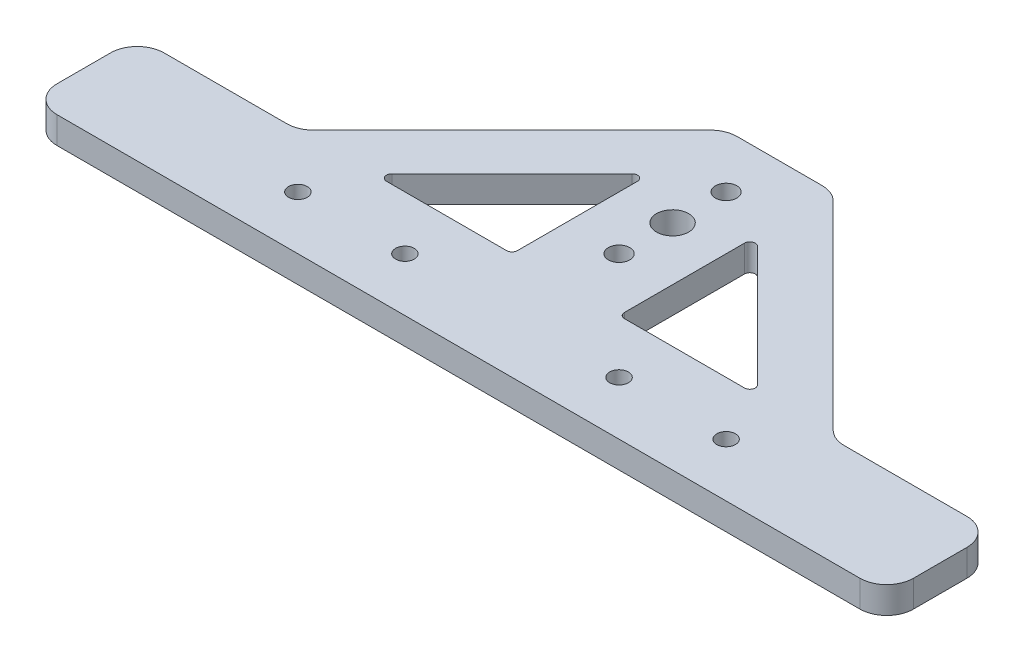
from build123d import *

# Parameters (mm, degrees)
ESBO_O1_R                = 1.75
RESSALTO_EXTRUS_O1_DEPTH = 5
ESBO_O4_W                = 30
ESBO_O4_H                = 20.000002677
RESSALTO_EXTRUS_O3_DEPTH = 5
ESBO_O5_R                = 3
CORTE_EXTRUS_O1_DEPTH    = 101.124923498
ESBO_O6_R                = 1.75
RESSALTO_EXTRUS_O5_DEPTH = 5
FILETE1_R                = 5
ESBO_O7_R                = 2
CORTE_EXTRUS_O2_DEPTH    = 101.124923498


with BuildPart() as part:
    # Esboço1 → Ressalto-extrusão1 (new body)
    with BuildSketch(Plane(origin=(0, 0, 0), x_dir=(1, 0, 0), z_dir=(0, 1, 0))):
        Polygon((-50, 0), (-50, 20.000002677), (-9.999996661, 60.000002546), (9.999996661, 60.000002546), (50, 20.000002677), (50, 0), align=None)
        with Locations(Location((-40, 10.000001339, 0), (0, 0, 270))):
            Circle(ESBO_O1_R, mode=Mode.SUBTRACT)
        with Locations(Location((-20, 10.000001339, 0), (0, 0, 270))):
            Circle(ESBO_O1_R, mode=Mode.SUBTRACT)
        with Locations(Location((0, 50.000002546, 0), (0, 0, 270))):
            Circle(ESBO_O1_R, mode=Mode.SUBTRACT)
        with Locations(Location((0, 30.000002546, 0), (0, 0, 270))):
            Circle(ESBO_O1_R, mode=Mode.SUBTRACT)
        with Locations(Location((20, 10.000001339, 0), (0, 0, 90))):
            Circle(ESBO_O1_R, mode=Mode.SUBTRACT)
        with Locations(Location((40, 10.000001339, 0), (0, 0, 90))):
            Circle(ESBO_O1_R, mode=Mode.SUBTRACT)
        with BuildLine():
            Line((-10, 43.443650782), (-10, 21.000001339))
            ThreePointArc((-10, 21.000001339), (-10.292893219, 20.292894558), (-11, 20.000001339))
            Line((-11, 20.000001339), (-33.443651391, 20.000001339))
            ThreePointArc((-33.443651391, 20.000001339), (-34.367530932, 20.617317926), (-34.150758141, 21.707108151))
            Line((-34.150758141, 21.707108151), (-11.707106751, 44.150757594))
            ThreePointArc((-11.707106751, 44.150757594), (-10.617316548, 44.367530307), (-10, 43.443650782))
        make_face(mode=Mode.SUBTRACT)
        with BuildLine():
            Line((11.707106751, 44.150757594), (34.150758141, 21.707108151))
            ThreePointArc((34.150758141, 21.707108151), (34.367530932, 20.617317926), (33.443651391, 20.000001339))
            Line((33.443651391, 20.000001339), (11, 20.000001339))
            ThreePointArc((11, 20.000001339), (10.292893219, 20.292894558), (10, 21.000001339))
            Line((10, 21.000001339), (10, 43.443650782))
            ThreePointArc((10, 43.443650782), (10.617316548, 44.367530307), (11.707106751, 44.150757594))
        make_face(mode=Mode.SUBTRACT)
    extrude(amount=RESSALTO_EXTRUS_O1_DEPTH)

    # Esboço4 → Ressalto-extrusão3 (add)
    with BuildSketch(Plane.XZ):
        with Locations((-65, -10.000001339)):
            Rectangle(ESBO_O4_W, ESBO_O4_H)
        with Locations((65, -10.000001339)):
            Rectangle(ESBO_O4_W, ESBO_O4_H)
    extrude(amount=-RESSALTO_EXTRUS_O3_DEPTH)

    # Esboço5 → Corte-extrusão1 (cut, through all)
    with BuildSketch(Plane.XZ):
        with Locations(Location((0, -40.000002546, 0), (0, 0, 270))):
            Circle(ESBO_O5_R)
    extrude(amount=-CORTE_EXTRUS_O1_DEPTH, mode=Mode.SUBTRACT)

    # Esboço6 → Ressalto-extrusão5 (add, through all)
    with BuildSketch(Plane.XZ):
        with Locations((0, -30.000002546)):
            Circle(ESBO_O6_R)
        with Locations((0, -50.000002546)):
            Circle(ESBO_O6_R)
    extrude(amount=-RESSALTO_EXTRUS_O5_DEPTH)

    # Filete1
    filete1_edges = [part.edges().sort_by_distance(p)[0] for p in [
        (-50, 2.5, -20.000002677),
        (-9.999996661, 2.5, -60.000002546),
        (9.999996661, 2.5, -60.000002546),
        (50, 2.5, -20.000002677),
        (-80, 2.5, -20.000002677),
        (-80, 2.5, 0),
        (80, 2.5, 0),
        (80, 2.5, -20.000002677),
    ]]
    fillet(filete1_edges, radius=FILETE1_R)

    # Esboço7 → Corte-extrusão2 (cut, through all)
    with BuildSketch(Plane.XZ):
        with Locations(Location((0, -50.000002546, 0), (0, 0, 270))):
            Circle(ESBO_O7_R)
        with Locations(Location((0, -30.000002546, 0), (0, 0, 270))):
            Circle(ESBO_O7_R)
    extrude(amount=-CORTE_EXTRUS_O2_DEPTH, mode=Mode.SUBTRACT)


solid = part.part
